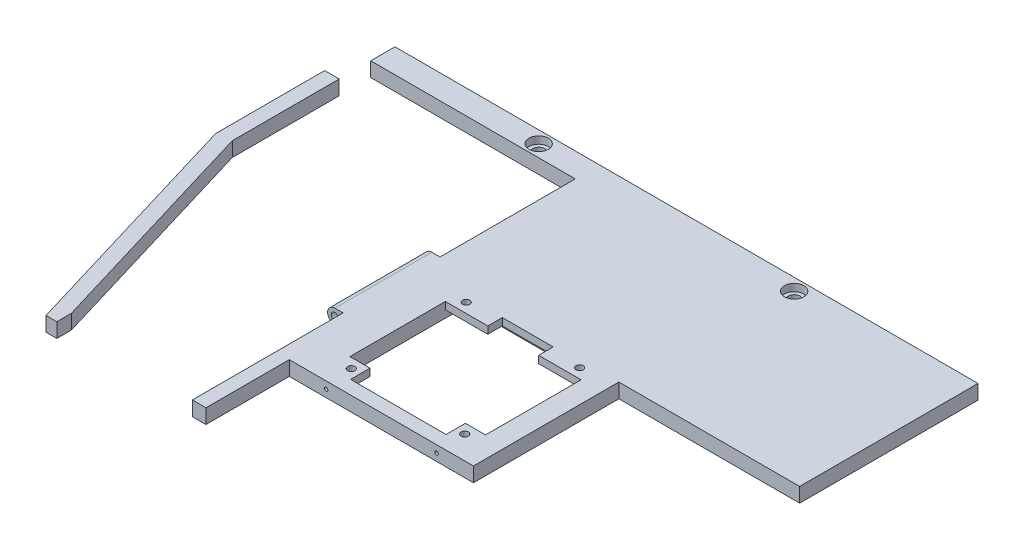
from build123d import *

# Parameters (mm, degrees)
SKETCH_1_W           = 120
SKETCH_1_H           = 34
EXTRUDE_1_DEPTH      = 3
SKETCH_2_R           = 1.25
CUT_EXTRUDE_1_DEPTH  = 63.433965115
SKETCH_2_3_R         = 2
CUT_EXTRUDE_2_DEPTH  = 1.5
EXTRUDE_2_DEPTH      = 3
SKETCH_5_W           = 27.767908047
SKETCH_5_H           = 3
CUT_EXTRUDE_3_DEPTH  = 90.988888203
SKETCH_6_R           = 1.5
SKETCH_6_R_2         = 0.75
EXTRUDE_3_DEPTH      = 79
SKETCH_7_W           = 1.5
SKETCH_7_H           = 3.2
SKETCH_7_W_2         = 1.7
SKETCH_7_H_2         = 27.900089606
SKETCH_7_H_3         = 27.899910394
CUT_EXTRUDE_5_DEPTH  = 90.988888203
SKETCH_9_W           = 3
SKETCH_9_H           = 11.5
CUT_EXTRUDE_8_DEPTH  = 90.988888203
CUT_EXTRUDE_9_DEPTH  = 1.5
SKETCH_12_R          = 0.35
CUT_EXTRUDE_10_DEPTH = 3
EXTRUDE_4_DEPTH      = 3
SKETCH_13_R          = 0.75
CUT_EXTRUDE_11_DEPTH = 93.221960508
SKETCH_15_W          = 19.7
SKETCH_15_H          = 4
SKETCH_15_W_2        = 10.5
SKETCH_15_H_2        = 3
CUT_EXTRUDE_14_DEPTH = 93.221960508
SKETCH_16_W          = 28
SKETCH_16_H          = 28.3
CUT_EXTRUDE_15_DEPTH = 1.5
SKETCH_18_R          = 0.35
CUT_EXTRUDE_16_DEPTH = 3


with BuildPart() as part:
    # 草图1 → 凸台-拉伸1 (new body)
    with BuildSketch(Plane(origin=(0, 0, 0), x_dir=(1, 0, 0), z_dir=(0, 1, 0))):
        Rectangle(SKETCH_1_W, SKETCH_1_H)
    extrude(amount=EXTRUDE_1_DEPTH)

    # 草图2 → 切除-拉伸1 (cut, through all)
    with BuildSketch(Plane(origin=(0, 3, 0), x_dir=(1, 0, 0), z_dir=(0, 1, 0))):
        with Locations(Location((-24.857141963, 14.500000041, 0), (0, 0, 270))):
            Circle(SKETCH_2_R)
        with Locations(Location((27.857143751, 14.500000041, 0), (0, 0, 270))):
            Circle(SKETCH_2_R)
    extrude(amount=-CUT_EXTRUDE_1_DEPTH, mode=Mode.SUBTRACT)

    # 草图2<3> → 切除-拉伸2 (cut)
    with BuildSketch(Plane(origin=(0, 3, 0), x_dir=(1, 0, 0), z_dir=(0, 1, 0))):
        with Locations(Location((-24.857141963, 14.500000041, 0), (0, 0, 270))):
            Circle(SKETCH_2_3_R)
        with Locations(Location((27.857143751, 14.500000041, 0), (0, 0, 270))):
            Circle(SKETCH_2_3_R)
    extrude(amount=-CUT_EXTRUDE_2_DEPTH, mode=Mode.SUBTRACT)

    # 草图4 → 凸台-拉伸2 (add)
    with BuildSketch(Plane(origin=(0, 0, 0), x_dir=(1, 0, 0), z_dir=(0, 1, 0))):
        Polygon((-12, -17), (-12, -67), (-45, -67), (-60, -17), align=None)
    extrude(amount=EXTRUDE_2_DEPTH)

    # 草图5 → 切除-拉伸3 (cut, through all)
    with BuildSketch(Plane(origin=(0, 3, 0), x_dir=(1, 0, 0), z_dir=(0, 1, 0))):
        Polygon((-42.767908047, -64), (-57, -16.559693491), (-57, 12), (-15, 12), (-15, -64), align=None)
        with Locations((-28.883954024, -65.5)):
            Rectangle(SKETCH_5_W, SKETCH_5_H)
    extrude(amount=-CUT_EXTRUDE_3_DEPTH, mode=Mode.SUBTRACT)

    # 草图6 → 凸台-拉伸3 (add)
    # profile 1 of 3: a face of its own
    with BuildSketch(Plane.XY.offset(67)):
        with Locations((-16.5, 1.5)):
            Circle(SKETCH_6_R)
        with Locations((-16.5, 1.5)):
            Circle(SKETCH_6_R_2, mode=Mode.SUBTRACT)
    # profile 2 of 3: a face of its own
    with BuildSketch(Plane.XY.offset(67)):
        with BuildLine():
            Line((-15, 1.5), (-15, 3))
            Line((-15, 3), (-16.5, 3))
            ThreePointArc((-16.5, 3), (-15.439339828, 2.560660172), (-15, 1.5))
        make_face()
    # profile 3 of 3: a face of its own
    with BuildSketch(Plane.XY.offset(67)):
        with BuildLine():
            Line((-15, 0), (-15, 1.5))
            ThreePointArc((-15, 1.5), (-15.439339828, 0.439339828), (-16.5, 0))
            Line((-16.5, 0), (-15, 0))
        make_face()
    extrude(amount=-EXTRUDE_3_DEPTH)

    # 草图7 → 切除-拉伸5 (cut, through all)
    with BuildSketch(Plane(origin=(0, 3, 0), x_dir=(1, 0, 0), z_dir=(0, 1, 0))):
        with Locations((-17.25, -65.4)):
            Rectangle(SKETCH_7_W, SKETCH_7_H)
        with Locations((-15.65, -65.4)):
            Rectangle(SKETCH_7_W_2, SKETCH_7_H)
        with Locations((-15.65, -49.849955197)):
            Rectangle(SKETCH_7_W_2, SKETCH_7_H_2)
        with Locations((-17.25, -49.849955197)):
            Rectangle(SKETCH_7_W, SKETCH_7_H_2)
        with Locations((-15.65, -1.949955197)):
            Rectangle(SKETCH_7_W_2, SKETCH_7_H_3)
        with Locations((-17.25, -1.949955197)):
            Rectangle(SKETCH_7_W, SKETCH_7_H_3)
    extrude(amount=-CUT_EXTRUDE_5_DEPTH, mode=Mode.SUBTRACT)

    # 草图9 → 切除-拉伸8 (cut, through all)
    with BuildSketch(Plane.XZ):
        with Locations((-58.5, -11.25)):
            Rectangle(SKETCH_9_W, SKETCH_9_H)
    extrude(amount=-CUT_EXTRUDE_8_DEPTH, mode=Mode.SUBTRACT)


with BuildPart() as cut_extrude_8_piece_1:
    # of the separate pieces the step leaves, piece 1, a body of its own (cut_extrude_8_pieces)
    add(part.part.solids().sort_by_distance((-12, 0, 17))[0])

    # 草图12 → 切除-拉伸10 (cut)
    with BuildSketch(Plane.ZY.offset(57)):
        with Locations((-14.5, 1.5)):
            Circle(SKETCH_12_R)
    extrude(amount=-CUT_EXTRUDE_10_DEPTH, mode=Mode.SUBTRACT)

    # 草图17 → 凸台-拉伸4 (add)
    with BuildSketch(Plane(origin=(0, 3, 0), x_dir=(1, 0, 0), z_dir=(0, 1, 0))):
        Polygon((63.3, 17), (60, 17), (60, -17), (-12, -17), (-12, -49.8), (26, -49.8), (26, -19.8), (63.3, -19.8), align=None)
    extrude(amount=-EXTRUDE_4_DEPTH)

    # 草图13 → 切除-拉伸11 (cut, through all)
    with BuildSketch(Plane(origin=(0, 3, 0), x_dir=(1, 0, 0), z_dir=(0, 1, 0))):
        with Locations(Location((19.4, -45, 0), (0, 0, 270))):
            Circle(SKETCH_13_R)
        with Locations(Location((-4, -45, 0), (0, 0, 270))):
            Circle(SKETCH_13_R)
        with Locations(Location((19.4, -21.3, 0), (0, 0, 270))):
            Circle(SKETCH_13_R)
        with Locations(Location((-4, -21.3, 0), (0, 0, 270))):
            Circle(SKETCH_13_R)
    extrude(amount=-CUT_EXTRUDE_11_DEPTH, mode=Mode.SUBTRACT)

    # 草图15 → 切除-拉伸14 (cut, through all)
    with BuildSketch(Plane(origin=(0, 3, 0), x_dir=(1, 0, 0), z_dir=(0, 1, 0))):
        Polygon((-2.15, -43), (17.55, -43), (21.7, -43), (21.7, -23.3), (12.95, -23.3), (2.45, -23.3), (-6.3, -23.3), (-6.3, -43), align=None)
        with Locations((7.7, -45)):
            Rectangle(SKETCH_15_W, SKETCH_15_H)
        with Locations((7.7, -21.8)):
            Rectangle(SKETCH_15_W_2, SKETCH_15_H_2)
    extrude(amount=-CUT_EXTRUDE_14_DEPTH, mode=Mode.SUBTRACT)

    # 草图16 → 切除-拉伸15 (cut)
    with BuildSketch(Plane(origin=(0, 0, 0), x_dir=(1, 0, 0), z_dir=(0, 1, 0))):
        with Locations((7.7, -33.15)):
            Rectangle(SKETCH_16_W, SKETCH_16_H)
    extrude(amount=CUT_EXTRUDE_15_DEPTH, mode=Mode.SUBTRACT)

    # 草图18 → 切除-拉伸16 (cut)
    with BuildSketch(Plane.XY.offset(49.8)):
        with Locations((18.4, 1.5)):
            Circle(SKETCH_18_R)
        with Locations((-4.4, 1.5)):
            Circle(SKETCH_18_R)
    extrude(amount=-CUT_EXTRUDE_16_DEPTH, mode=Mode.SUBTRACT)


with BuildPart() as cut_extrude_8_piece_2:
    # of the separate pieces the step leaves, piece 2, a body of its own (cut_extrude_8_pieces)
    add(part.part.solids().sort_by_distance((-57, 0, -5.5))[0])

    # 草图10 → 切除-拉伸9 (cut)
    with BuildSketch(Plane.XZ):
        Polygon((-58, -5.5), (-58, 16.706462327), (-43.211938698, 66), (-44.255969349, 66), (-59, 16.853231164), (-59, -5.5), align=None)
    extrude(amount=-CUT_EXTRUDE_9_DEPTH, mode=Mode.SUBTRACT)


solid = Compound([cut_extrude_8_piece_1.part, cut_extrude_8_piece_2.part])
